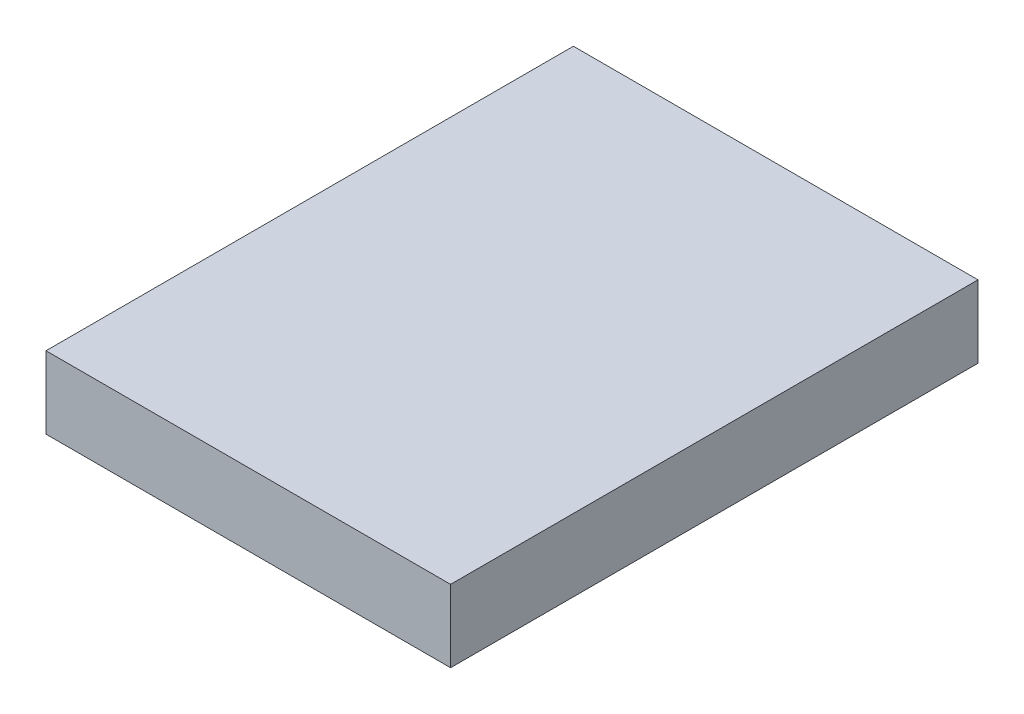
from build123d import *

# Parameters (mm, degrees)
SKETCH1_W           = 112
SKETCH1_H           = 146
BOSS_EXTRUDE1_DEPTH = 20


with BuildPart() as part:
    # Sketch1 → Boss-Extrude1 (new body)
    with BuildSketch(Plane(origin=(0, 0, 0), x_dir=(1, 0, 0), z_dir=(0, 1, 0))):
        with Locations((56, 73)):
            Rectangle(SKETCH1_W, SKETCH1_H)
    extrude(amount=BOSS_EXTRUDE1_DEPTH)


solid = part.part
